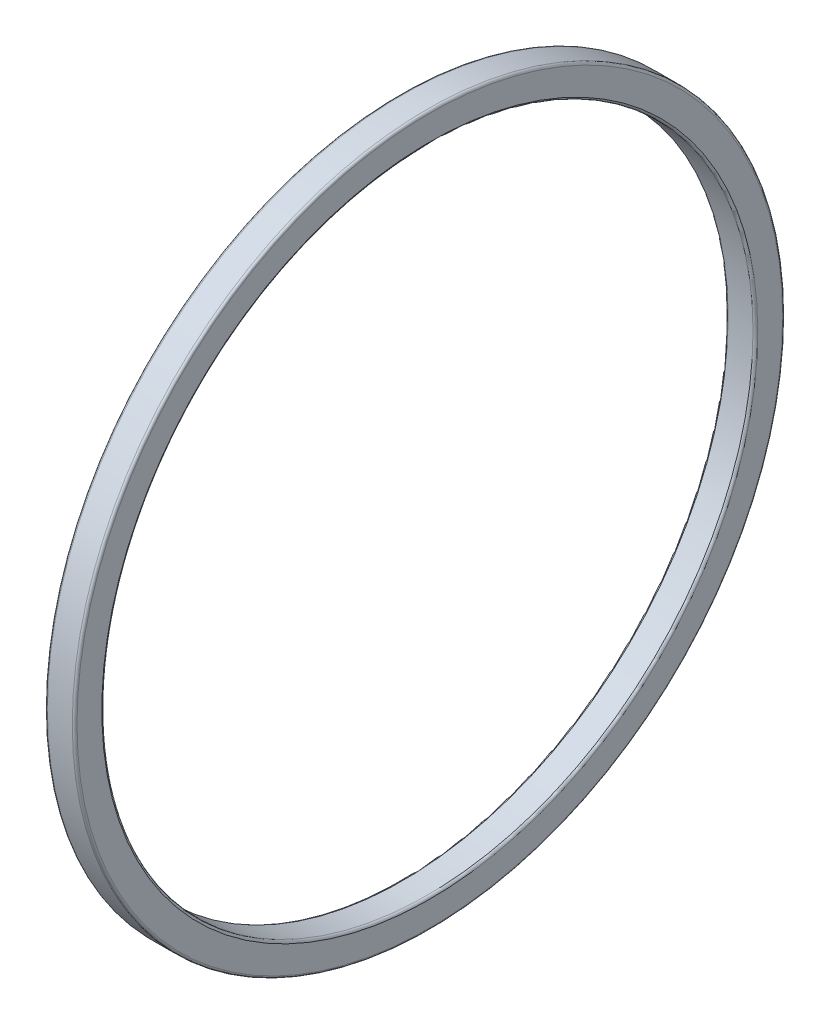
from build123d import *

# Parameters (mm, degrees)
SKETCH1_R           = 76.2
SKETCH1_R_2         = 69.85
BOSS_EXTRUDE1_DEPTH = 3.175
FILLET1_R           = 0.508


with BuildPart() as part:
    # Sketch1 → Boss-Extrude1 (new, symmetric)
    with BuildSketch(Plane(origin=(0, 0, 0), x_dir=(0, 0, -1), z_dir=(1, 0, 0))):
        Circle(SKETCH1_R)
        Circle(SKETCH1_R_2, mode=Mode.SUBTRACT)
    extrude(amount=BOSS_EXTRUDE1_DEPTH, both=True)

    # Fillet1
    fillet1_edges = [part.edges().sort_by_distance(p)[0] for p in [
        (-3.175, 0, 76.2),
        (3.175, 0, 76.2),
        (-3.175, 0, 69.85),
        (3.175, 0, 69.85),
    ]]
    fillet(fillet1_edges, radius=FILLET1_R)


solid = part.part
